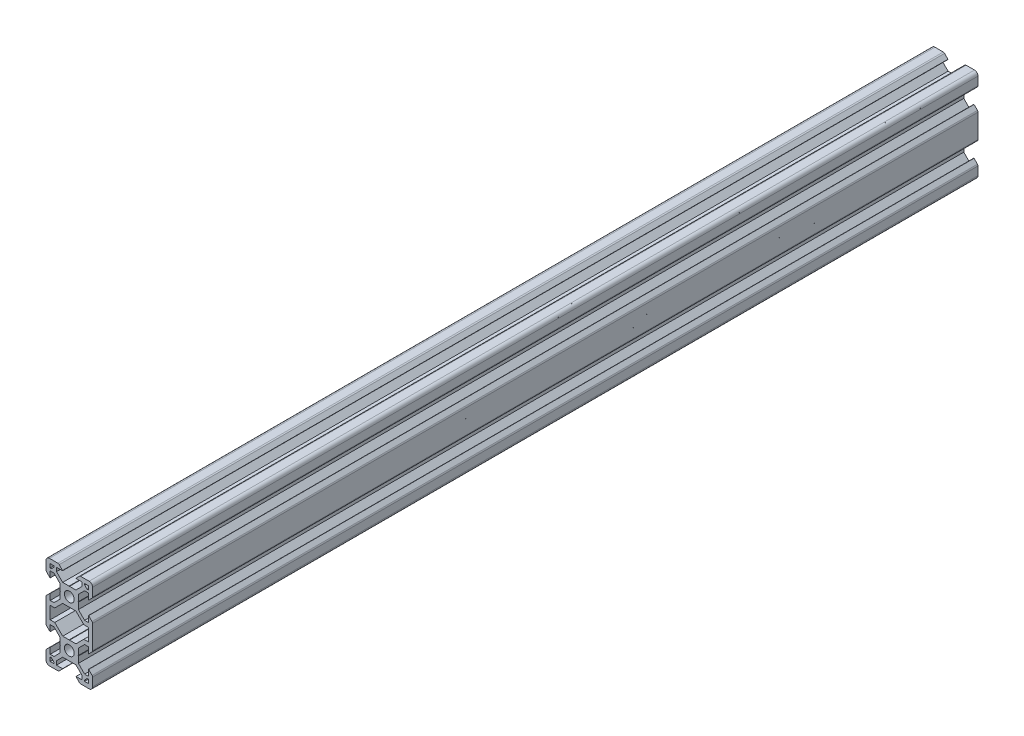
from build123d import *

# Parameters (mm, degrees)
SKETCH2_R           = 2.1
BOSS_EXTRUDE1_DEPTH = 380


with BuildPart() as part:
    # Sketch2 → Boss-Extrude1 (new body)
    with BuildSketch(Plane.XY):
        with BuildLine():
            Line((-0.1, 3.9), (0, 3.8))
            Line((0, 3.8), (0.1, 3.9))
            Line((0.1, 3.9), (2.840365134, 3.9))
            Line((2.840365134, 3.9), (5.5, 6.558825842))
            Line((5.5, 6.558825842), (5.5, 8.197505675))
            Line((5.5, 8.197505675), (2.89, 8.197505675))
            Line((2.89, 8.197505675), (2.89, 8.307505675))
            Line((2.89, 8.307505675), (4.348614357, 9.766120032))
            ThreePointArc((4.348614357, 9.766120032), (4.604908803, 9.937370505), (4.907228714, 9.997505675))
            Line((4.907228714, 9.997505675), (8.5, 9.997505675))
            ThreePointArc((8.5, 9.997505675), (9.560660172, 9.558165846), (10, 8.497505675))
            Line((10, 8.497505675), (10, 4.904734389))
            ThreePointArc((10, 4.904734389), (9.939864831, 4.602414477), (9.768614357, 4.346120032))
            Line((9.768614357, 4.346120032), (8.31, 2.887505675))
            Line((8.31, 2.887505675), (8.2, 2.887505675))
            Line((8.2, 2.887505675), (8.2, 5.497505675))
            Line((8.2, 5.497505675), (6.56, 5.497505675))
            Line((6.56, 5.497505675), (3.9, 2.83831481))
            Line((3.9, 2.83831481), (3.9, 0.1))
            Line((3.9, 0.1), (3.8, 0))
            Line((3.8, 0), (3.9, -0.1))
            Line((3.9, -0.1), (3.9, -2.84))
            Line((3.9, -2.84), (6.56, -5.5))
            Line((6.56, -5.5), (8.2, -5.5))
            Line((8.2, -5.5), (8.2, -2.89))
            Line((8.2, -2.89), (8.31, -2.89))
            Line((8.31, -2.89), (9.765685425, -4.345685425))
            ThreePointArc((9.765685425, -4.345685425), (9.939103626, -4.605224104), (10, -4.91137085))
            Line((10, -4.91137085), (10, -15.08862915))
            ThreePointArc((10, -15.08862915), (9.939103626, -15.394775896), (9.765685425, -15.654314575))
            Line((9.765685425, -15.654314575), (8.31, -17.11))
            Line((8.31, -17.11), (8.2, -17.11))
            Line((8.2, -17.11), (8.2, -14.5))
            Line((8.2, -14.5), (6.56, -14.5))
            Line((6.56, -14.5), (3.9, -17.16))
            Line((3.9, -17.16), (3.9, -19.9))
            Line((3.9, -19.9), (3.8, -20))
            Line((3.8, -20), (3.9, -20.1))
            Line((3.9, -20.1), (3.9, -22.83831481))
            Line((3.9, -22.83831481), (6.56, -25.497505675))
            Line((6.56, -25.497505675), (8.2, -25.497505675))
            Line((8.2, -25.497505675), (8.2, -22.887505675))
            Line((8.2, -22.887505675), (8.31, -22.887505675))
            Line((8.31, -22.887505675), (9.768614357, -24.346120032))
            ThreePointArc((9.768614357, -24.346120032), (9.939864831, -24.602414477), (10, -24.904734389))
            Line((10, -24.904734389), (10, -28.497505675))
            ThreePointArc((10, -28.497505675), (9.560660172, -29.558165846), (8.5, -29.997505675))
            Line((8.5, -29.997505675), (4.907228714, -29.997505675))
            ThreePointArc((4.907228714, -29.997505675), (4.604908803, -29.937370505), (4.348614357, -29.766120032))
            Line((4.348614357, -29.766120032), (2.89, -28.307505675))
            Line((2.89, -28.307505675), (2.89, -28.197505675))
            Line((2.89, -28.197505675), (5.5, -28.197505675))
            Line((5.5, -28.197505675), (5.5, -26.558825842))
            Line((5.5, -26.558825842), (2.840365134, -23.9))
            Line((2.840365134, -23.9), (0.1, -23.9))
            Line((0.1, -23.9), (0, -23.8))
            Line((0, -23.8), (-0.1, -23.9))
            Line((-0.1, -23.9), (-2.840365134, -23.9))
            Line((-2.840365134, -23.9), (-5.5, -26.558825842))
            Line((-5.5, -26.558825842), (-5.5, -28.197505675))
            Line((-5.5, -28.197505675), (-2.89, -28.197505675))
            Line((-2.89, -28.197505675), (-2.89, -28.307505675))
            Line((-2.89, -28.307505675), (-4.348614357, -29.766120032))
            ThreePointArc((-4.348614357, -29.766120032), (-4.604908803, -29.937370505), (-4.907228714, -29.997505675))
            Line((-4.907228714, -29.997505675), (-8.5, -29.997505675))
            ThreePointArc((-8.5, -29.997505675), (-9.560660172, -29.558165846), (-10, -28.497505675))
            Line((-10, -28.497505675), (-10, -24.904734389))
            ThreePointArc((-10, -24.904734389), (-9.939864831, -24.602414477), (-9.768614357, -24.346120032))
            Line((-9.768614357, -24.346120032), (-8.31, -22.887505675))
            Line((-8.31, -22.887505675), (-8.2, -22.887505675))
            Line((-8.2, -22.887505675), (-8.2, -25.497505675))
            Line((-8.2, -25.497505675), (-6.56, -25.497505675))
            Line((-6.56, -25.497505675), (-3.9, -22.83831481))
            Line((-3.9, -22.83831481), (-3.9, -20.1))
            Line((-3.9, -20.1), (-3.8, -20))
            Line((-3.8, -20), (-3.9, -19.9))
            Line((-3.9, -19.9), (-3.9, -17.16))
            Line((-3.9, -17.16), (-6.56, -14.5))
            Line((-6.56, -14.5), (-8.2, -14.5))
            Line((-8.2, -14.5), (-8.2, -17.11))
            Line((-8.2, -17.11), (-8.31, -17.11))
            Line((-8.31, -17.11), (-9.765685425, -15.654314575))
            ThreePointArc((-9.765685425, -15.654314575), (-9.939103626, -15.394775896), (-10, -15.08862915))
            Line((-10, -15.08862915), (-10, -4.91137085))
            ThreePointArc((-10, -4.91137085), (-9.939103626, -4.605224104), (-9.765685425, -4.345685425))
            Line((-9.765685425, -4.345685425), (-8.31, -2.89))
            Line((-8.31, -2.89), (-8.2, -2.89))
            Line((-8.2, -2.89), (-8.2, -5.5))
            Line((-8.2, -5.5), (-6.56, -5.5))
            Line((-6.56, -5.5), (-3.9, -2.84))
            Line((-3.9, -2.84), (-3.9, -0.1))
            Line((-3.9, -0.1), (-3.8, 0))
            Line((-3.8, 0), (-3.9, 0.1))
            Line((-3.9, 0.1), (-3.9, 2.83831481))
            Line((-3.9, 2.83831481), (-6.56, 5.497505675))
            Line((-6.56, 5.497505675), (-8.2, 5.497505675))
            Line((-8.2, 5.497505675), (-8.2, 2.887505675))
            Line((-8.2, 2.887505675), (-8.31, 2.887505675))
            Line((-8.31, 2.887505675), (-9.768614357, 4.346120032))
            ThreePointArc((-9.768614357, 4.346120032), (-9.939864831, 4.602414477), (-10, 4.904734389))
            Line((-10, 4.904734389), (-10, 8.497505675))
            ThreePointArc((-10, 8.497505675), (-9.560660172, 9.558165846), (-8.5, 9.997505675))
            Line((-8.5, 9.997505675), (-4.907228714, 9.997505675))
            ThreePointArc((-4.907228714, 9.997505675), (-4.604908803, 9.937370505), (-4.348614357, 9.766120032))
            Line((-4.348614357, 9.766120032), (-2.89, 8.307505675))
            Line((-2.89, 8.307505675), (-2.89, 8.197505675))
            Line((-2.89, 8.197505675), (-5.5, 8.197505675))
            Line((-5.5, 8.197505675), (-5.5, 6.558825842))
            Line((-5.5, 6.558825842), (-2.840365134, 3.9))
            Line((-2.840365134, 3.9), (-0.1, 3.9))
        make_face()
        Circle(SKETCH2_R, mode=Mode.SUBTRACT)
        with Locations(Location((0, -20, 0), (0, 0, 180))):
            Circle(SKETCH2_R, mode=Mode.SUBTRACT)
        Polygon((-7.66, 6.567505675), (-6.57, 7.657505675), (-6.57, 8.197505675), (-8.2, 8.197505675), (-8.2, 6.567505675), align=None, mode=Mode.SUBTRACT)
        Polygon((-0.1, -3.9), (0, -3.8), (0.1, -3.9), (2.840365134, -3.9), (6.24, -7.299634866), (8.2, -7.299634866), (8.2, -12.700365134), (6.24, -12.700365134), (2.840365134, -16.1), (0.1, -16.1), (0, -16.2), (-0.1, -16.1), (-2.840365134, -16.1), (-6.24, -12.700365134), (-8.2, -12.700365134), (-8.2, -7.299634866), (-6.24, -7.299634866), (-2.840365134, -3.9), align=None, mode=Mode.SUBTRACT)
        Polygon((8.2, 6.567505675), (7.66, 6.567505675), (6.57, 7.657505675), (6.57, 8.197505675), (8.2, 8.197505675), align=None, mode=Mode.SUBTRACT)
        Polygon((7.66, -26.567505675), (6.57, -27.657505675), (6.57, -28.197505675), (8.2, -28.197505675), (8.2, -26.567505675), align=None, mode=Mode.SUBTRACT)
        Polygon((-8.2, -26.567505675), (-7.66, -26.567505675), (-6.57, -27.657505675), (-6.57, -28.197505675), (-8.2, -28.197505675), align=None, mode=Mode.SUBTRACT)
    extrude(amount=-BOSS_EXTRUDE1_DEPTH)


solid = part.part
